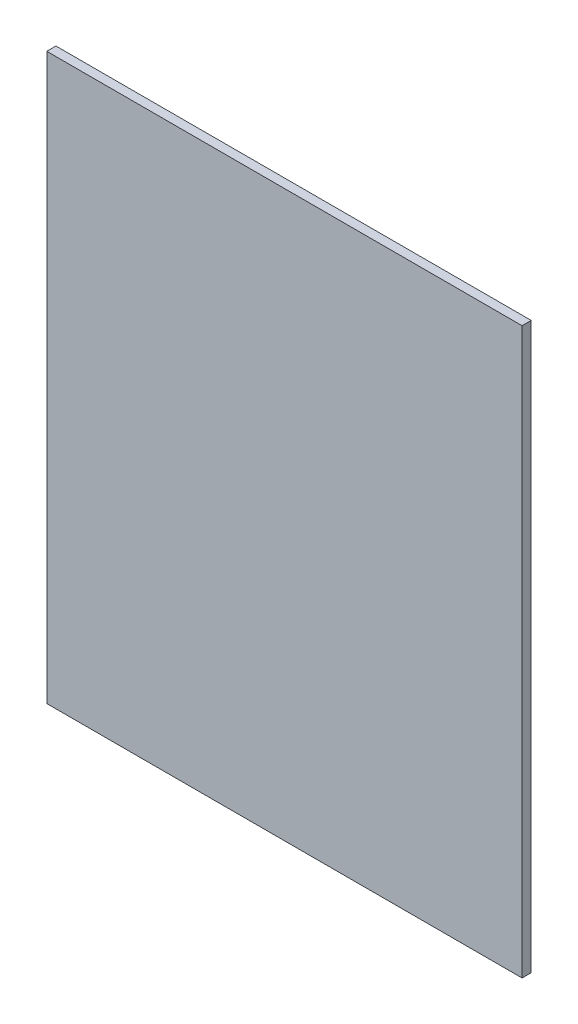
from build123d import *

# Parameters (mm, degrees)
ESQUISSE1_W        = 260
ESQUISSE1_H        = 309
BOSS_EXTRU_1_DEPTH = 5


with BuildPart() as part:
    # Esquisse1 → Boss.-Extru.1 (new body)
    with BuildSketch(Plane.XY):
        Rectangle(ESQUISSE1_W, ESQUISSE1_H)
    extrude(amount=BOSS_EXTRU_1_DEPTH)


solid = part.part
